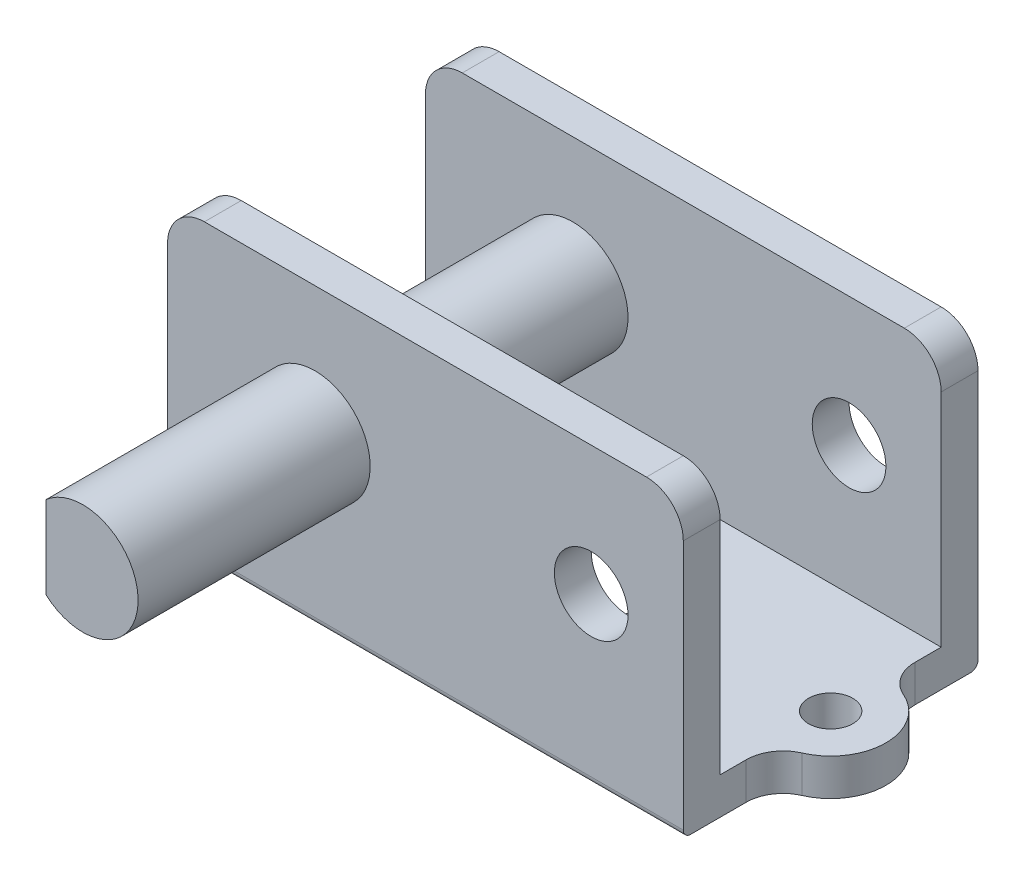
from build123d import *

# Parameters (mm, degrees)
EXTRUDE1_DEPTH      = 4
EXTRUDE2_DEPTH      = 12.357816692
EXTRUDE2_DEPTH_BACK = 12.357816692
SKETCH2_R           = 1
EXTRUDE3_DEPTH      = 12.357816692
EXTRUDE3_DEPTH_BACK = 12.357816692
SKETCH4_W           = 6
SKETCH4_H           = 8.732029078
FILLET1_R           = 0.2
FILLET2_R           = 1
EXTRUDE4_DEPTH      = 14
EXTRUDE4_DEPTH_BACK = 3
SKETCH3_R           = 1.5
EXTRUDE5_DEPTH      = 9
SKETCH6_R           = 1.5
EXTRUDE6_DEPTH      = 1
SKETCH7_R           = 0.6
EXTRUDE7_DEPTH      = 1
FILLET3_R           = 1
SKETCH8_R           = 2
EXTRUDE8_DEPTH      = 1
EXTRUDE9_START      = 6.3
SKETCH9_R           = 2.172550551
EXTRUDE9_DEPTH      = 10


with BuildPart() as part:
    # Sketch1 → Extrude1 (new, symmetric)
    with BuildSketch(Plane.XY):
        Polygon((0, 0), (-7, 0), (-7, 8), (7, 8), (7, 0), align=None)
    extrude(amount=EXTRUDE1_DEPTH, both=True)

    # Sketch2 → Extrude2 (cut, two sides: drawn at the far end of the back side and taken through both)
    with BuildSketch(Plane.XY.offset(-EXTRUDE2_DEPTH_BACK)):
        with Locations((4.5, 4.5)):
            Circle(SKETCH2_R)
    extrude(amount=EXTRUDE2_DEPTH + EXTRUDE2_DEPTH_BACK, mode=Mode.SUBTRACT)

    # Sketch4 → Extrude3 (cut, two sides: drawn at the far end of the back side and taken through both)
    with BuildSketch(Plane(origin=(0, 0, 0), x_dir=(0, 0, -1), z_dir=(1, 0, 0)).offset(-EXTRUDE3_DEPTH_BACK)):
        with Locations((0, 5.366014539)):
            Rectangle(SKETCH4_W, SKETCH4_H)
    extrude(amount=EXTRUDE3_DEPTH + EXTRUDE3_DEPTH_BACK, mode=Mode.SUBTRACT)

    # Fillet1
    fillet1_edges = [part.edges().sort_by_distance(p)[0] for p in [
        (0, 0, 4),
        (0, 0, -4),
    ]]
    fillet(fillet1_edges, radius=FILLET1_R)

    # Fillet2
    fillet2_edges = [part.edges().sort_by_distance(p)[0] for p in [
        (-7, 8, -3.5),
        (7, 8, -3.5),
        (-7, 8, 3.5),
        (7, 8, 3.5),
    ]]
    fillet(fillet2_edges, radius=FILLET2_R)

    # Sketch3 → Extrude4 (add, two sides: drawn at the far end of the back side and taken through both)
    with BuildSketch(Plane.XY.offset(-EXTRUDE4_DEPTH_BACK)):
        with Locations((-3, 4.5)):
            Circle(SKETCH3_R)
    extrude(amount=EXTRUDE4_DEPTH + EXTRUDE4_DEPTH_BACK)

    # Sketch5 → Extrude5 (cut)
    with BuildSketch(Plane.XY.offset(14)):
        Polygon((-4, 4.5), (-4, 6.060686456), (-4.95644391, 6.060686456), (-4.95644391, 2.5), (-4, 2.5), align=None)
    extrude(amount=-EXTRUDE5_DEPTH, mode=Mode.SUBTRACT)

    # Sketch6 → Extrude6 (add)
    with BuildSketch(Plane.XZ):
        with Locations((-7, 0)):
            Circle(SKETCH6_R)
        with Locations((7, 0)):
            Circle(SKETCH6_R)
    extrude(amount=-EXTRUDE6_DEPTH)

    # Sketch7 → Extrude7 (cut)
    with BuildSketch(Plane.XZ):
        with Locations((-7, 0)):
            Circle(SKETCH7_R)
        with Locations((7, 0)):
            Circle(SKETCH7_R)
    extrude(amount=-EXTRUDE7_DEPTH, mode=Mode.SUBTRACT)

    # Fillet3
    fillet3_edges = [part.edges().sort_by_distance(p)[0] for p in [
        (7, 0.5, -1.5),
        (7, 0.5, 1.5),
        (-7, 0.5, 1.5),
        (-7, 0.5, -1.5),
    ]]
    fillet(fillet3_edges, radius=FILLET3_R)

    # Sketch8 → Extrude8 (cut)
    with BuildSketch(Plane.XZ):
        Circle(SKETCH8_R)
    extrude(amount=-EXTRUDE8_DEPTH, mode=Mode.SUBTRACT)

    # Sketch9 → Extrude9 (cut)
    with BuildSketch(Plane.XY.offset(4).offset(EXTRUDE9_START)):
        with Locations((-3, 4.5)):
            Circle(SKETCH9_R)
    extrude(amount=EXTRUDE9_DEPTH, mode=Mode.SUBTRACT)


solid = part.part
